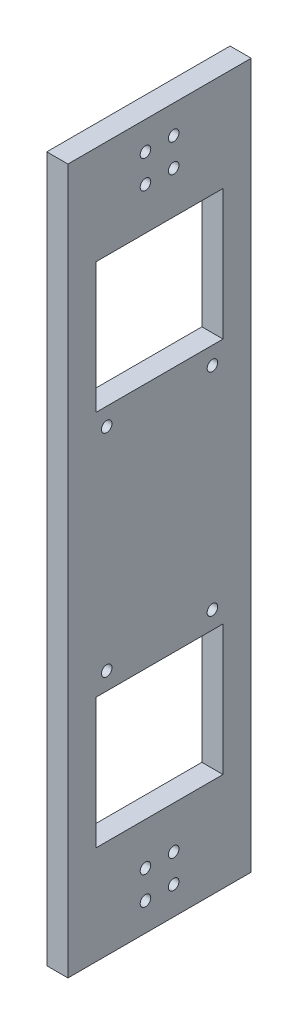
from build123d import *

# Parameters (mm, degrees)
SKETCH1_W           = 52
SKETCH1_H           = 200
BOSS_EXTRUDE1_DEPTH = 6
SKETCH2_R           = 1.5
CUT_EXTRUDE2_DEPTH  = 6
SKETCH3_R           = 1.5
CUT_EXTRUDE4_DEPTH  = 6
SKETCH4_R           = 1.5
CUT_EXTRUDE6_DEPTH  = 6
SKETCH5_R           = 1.5
CUT_EXTRUDE8_DEPTH  = 6
SKETCH6_R           = 1.5
CUT_EXTRUDE10_DEPTH = 6
SKETCH7_R           = 1.5
CUT_EXTRUDE12_DEPTH = 6
SKETCH8_R           = 1.5
CUT_EXTRUDE14_DEPTH = 6
SKETCH9_R           = 1.5
CUT_EXTRUDE16_DEPTH = 6
SKETCH10_R          = 1.5
CUT_EXTRUDE18_DEPTH = 6
SKETCH11_R          = 1.5
CUT_EXTRUDE20_DEPTH = 6
SKETCH12_R          = 1.5
CUT_EXTRUDE22_DEPTH = 6
SKETCH13_R          = 1.5
CUT_EXTRUDE24_DEPTH = 6
SKETCH14_W          = 36
SKETCH14_H          = 37
CUT_EXTRUDE26_DEPTH = 6
SKETCH15_W          = 36
SKETCH15_H          = 37
CUT_EXTRUDE28_DEPTH = 6


with BuildPart() as part:
    # Sketch1 → Boss-Extrude1 (new body)
    with BuildSketch(Plane(origin=(-132.7, 0, 0), x_dir=(0, 0, -1), z_dir=(1, 0, 0))):
        Rectangle(SKETCH1_W, SKETCH1_H)
    extrude(amount=BOSS_EXTRUDE1_DEPTH)

    # Sketch2 → Cut-Extrude2 (cut)
    with BuildSketch(Plane(origin=(-132.7, 0, 0), x_dir=(0, 0, -1), z_dir=(1, 0, 0))):
        with Locations((-4, 84)):
            Circle(SKETCH2_R)
    extrude(amount=CUT_EXTRUDE2_DEPTH, mode=Mode.SUBTRACT)

    # Sketch3 → Cut-Extrude4 (cut)
    with BuildSketch(Plane(origin=(-132.7, 0, 0), x_dir=(0, 0, -1), z_dir=(1, 0, 0))):
        with Locations((4, 84)):
            Circle(SKETCH3_R)
    extrude(amount=CUT_EXTRUDE4_DEPTH, mode=Mode.SUBTRACT)

    # Sketch4 → Cut-Extrude6 (cut)
    with BuildSketch(Plane(origin=(-132.7, 0, 0), x_dir=(0, 0, -1), z_dir=(1, 0, 0))):
        with Locations((-4, 92)):
            Circle(SKETCH4_R)
    extrude(amount=CUT_EXTRUDE6_DEPTH, mode=Mode.SUBTRACT)

    # Sketch5 → Cut-Extrude8 (cut)
    with BuildSketch(Plane(origin=(-132.7, 0, 0), x_dir=(0, 0, -1), z_dir=(1, 0, 0))):
        with Locations((4, 92)):
            Circle(SKETCH5_R)
    extrude(amount=CUT_EXTRUDE8_DEPTH, mode=Mode.SUBTRACT)

    # Sketch6 → Cut-Extrude10 (cut)
    with BuildSketch(Plane(origin=(-132.7, 0, 0), x_dir=(0, 0, -1), z_dir=(1, 0, 0))):
        with Locations((-4, -92)):
            Circle(SKETCH6_R)
    extrude(amount=CUT_EXTRUDE10_DEPTH, mode=Mode.SUBTRACT)

    # Sketch7 → Cut-Extrude12 (cut)
    with BuildSketch(Plane(origin=(-132.7, 0, 0), x_dir=(0, 0, -1), z_dir=(1, 0, 0))):
        with Locations((4, -92)):
            Circle(SKETCH7_R)
    extrude(amount=CUT_EXTRUDE12_DEPTH, mode=Mode.SUBTRACT)

    # Sketch8 → Cut-Extrude14 (cut)
    with BuildSketch(Plane(origin=(-132.7, 0, 0), x_dir=(0, 0, -1), z_dir=(1, 0, 0))):
        with Locations((-4, -84)):
            Circle(SKETCH8_R)
    extrude(amount=CUT_EXTRUDE14_DEPTH, mode=Mode.SUBTRACT)

    # Sketch9 → Cut-Extrude16 (cut)
    with BuildSketch(Plane(origin=(-132.7, 0, 0), x_dir=(0, 0, -1), z_dir=(1, 0, 0))):
        with Locations((4, -84)):
            Circle(SKETCH9_R)
    extrude(amount=CUT_EXTRUDE16_DEPTH, mode=Mode.SUBTRACT)

    # Sketch10 → Cut-Extrude18 (cut)
    with BuildSketch(Plane(origin=(-132.7, 0, 0), x_dir=(0, 0, -1), z_dir=(1, 0, 0))):
        with Locations((-15, -30)):
            Circle(SKETCH10_R)
    extrude(amount=CUT_EXTRUDE18_DEPTH, mode=Mode.SUBTRACT)

    # Sketch11 → Cut-Extrude20 (cut)
    with BuildSketch(Plane(origin=(-132.7, 0, 0), x_dir=(0, 0, -1), z_dir=(1, 0, 0))):
        with Locations((15, -30)):
            Circle(SKETCH11_R)
    extrude(amount=CUT_EXTRUDE20_DEPTH, mode=Mode.SUBTRACT)

    # Sketch12 → Cut-Extrude22 (cut)
    with BuildSketch(Plane(origin=(-132.7, 0, 0), x_dir=(0, 0, -1), z_dir=(1, 0, 0))):
        with Locations((-15, 30)):
            Circle(SKETCH12_R)
    extrude(amount=CUT_EXTRUDE22_DEPTH, mode=Mode.SUBTRACT)

    # Sketch13 → Cut-Extrude24 (cut)
    with BuildSketch(Plane(origin=(-132.7, 0, 0), x_dir=(0, 0, -1), z_dir=(1, 0, 0))):
        with Locations((15, 30)):
            Circle(SKETCH13_R)
    extrude(amount=CUT_EXTRUDE24_DEPTH, mode=Mode.SUBTRACT)

    # Sketch14 → Cut-Extrude26 (cut)
    with BuildSketch(Plane(origin=(-132.7, 0, 0), x_dir=(0, 0, -1), z_dir=(1, 0, 0))):
        with Locations((0, 53.5)):
            Rectangle(SKETCH14_W, SKETCH14_H)
    extrude(amount=CUT_EXTRUDE26_DEPTH, mode=Mode.SUBTRACT)

    # Sketch15 → Cut-Extrude28 (cut)
    with BuildSketch(Plane(origin=(-132.7, 0, 0), x_dir=(0, 0, -1), z_dir=(1, 0, 0))):
        with Locations((0, -53.5)):
            Rectangle(SKETCH15_W, SKETCH15_H)
    extrude(amount=CUT_EXTRUDE28_DEPTH, mode=Mode.SUBTRACT)


solid = part.part
